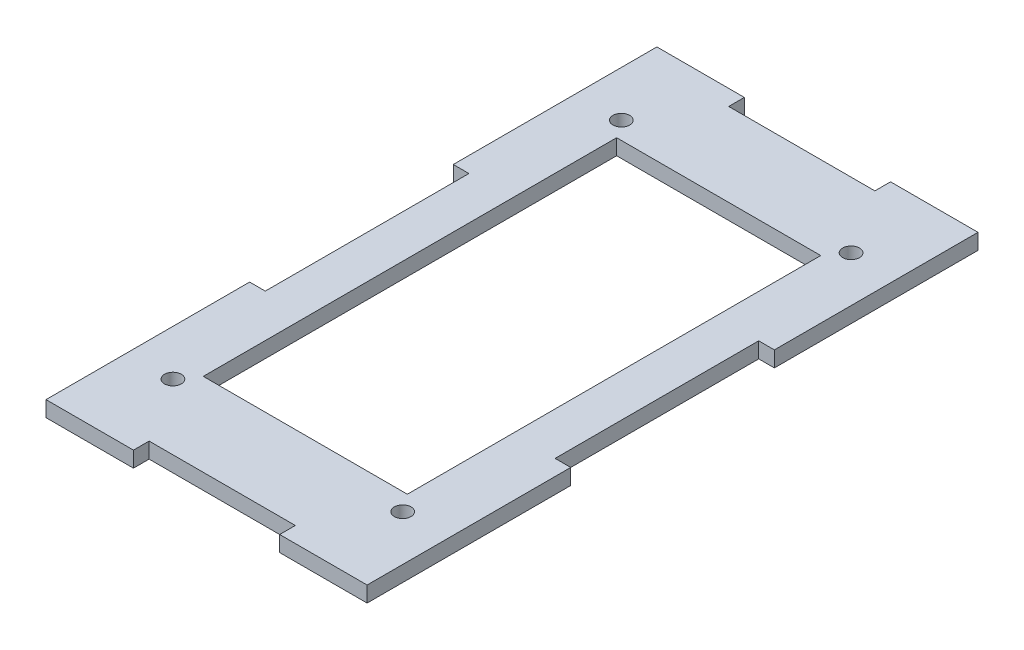
from build123d import *

# Parameters (mm, degrees)
SKETCH1_R           = 1.609204822
BOSS_EXTRUDE1_DEPTH = 3
SKETCH2_W           = 39.09
SKETCH2_H           = 79.17
CUT_EXTRUDE1_DEPTH  = 67.15748257


with BuildPart() as part:
    # Sketch1 → Boss-Extrude1 (new body)
    with BuildSketch(Plane(origin=(0, 0, 0), x_dir=(1, 0, 0), z_dir=(0, 1, 0))):
        Polygon((-30.75, 58.5), (-30.75, 19.5), (-27.75, 19.5), (-27.75, -19.5), (-30.75, -19.5), (-30.75, -58.5), (-14, -58.5), (-14, -55.5), (14, -55.5), (14, -58.5), (30.75, -58.5), (30.75, -19.5), (27.75, -19.5), (27.75, 19.5), (30.75, 19.5), (30.75, 58.5), (14, 58.5), (14, 55.5), (-14, 55.5), (-14, 58.5), align=None)
        with Locations(Location((-22, -42.94, 0), (0, 0, 270))):
            Circle(SKETCH1_R, mode=Mode.SUBTRACT)
        with Locations(Location((22, -42.94, 0), (0, 0, 270))):
            Circle(SKETCH1_R, mode=Mode.SUBTRACT)
        with Locations(Location((22, 42.94, 0), (0, 0, 270))):
            Circle(SKETCH1_R, mode=Mode.SUBTRACT)
        with Locations(Location((-22, 42.94, 0), (0, 0, 270))):
            Circle(SKETCH1_R, mode=Mode.SUBTRACT)
    extrude(amount=BOSS_EXTRUDE1_DEPTH)

    # Sketch2 → Cut-Extrude1 (cut, through all)
    with BuildSketch(Plane(origin=(0, 3, 0), x_dir=(1, 0, 0), z_dir=(0, 1, 0))):
        Rectangle(SKETCH2_W, SKETCH2_H)
    extrude(amount=-CUT_EXTRUDE1_DEPTH, mode=Mode.SUBTRACT)


solid = part.part
